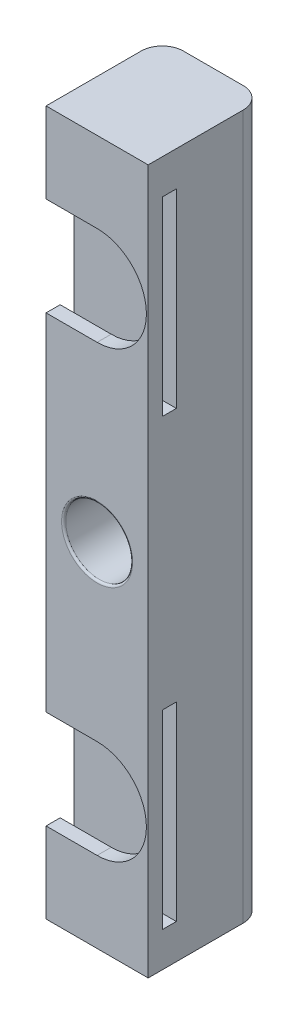
from build123d import *

# Parameters (mm, degrees)
SKETCH7_W           = 100
SKETCH7_H           = 14.5
BOSS_EXTRUDE1_DEPTH = 16.5
SKETCH8_R           = 4.75
CUT_EXTRUDE2_DEPTH  = 16
CUT_EXTRUDE3_START  = -2
SKETCH9_W           = 27
SKETCH9_H           = 27
CUT_EXTRUDE3_DEPTH  = 2
CUT_EXTRUDE4_DEPTH  = 2
FILLET1_R           = 3
FILLET2_R           = 3
FILLET3_R           = 0.3


with BuildPart() as part:
    # Sketch7 → Boss-Extrude1 (new body)
    with BuildSketch(Plane(origin=(0, 0, 0), x_dir=(0, 1, 0), z_dir=(0, 0, 1))):
        Rectangle(SKETCH7_W, SKETCH7_H)
    extrude(amount=BOSS_EXTRUDE1_DEPTH)

    # Sketch8 → Cut-Extrude2 (cut)
    with BuildSketch(Plane(origin=(0, 0, 16.5), x_dir=(0, -1, 0), z_dir=(0, 0, 1))):
        with Locations(Location((0, 0, 0), (0, 0, 90))):
            Circle(SKETCH8_R)
    extrude(amount=-CUT_EXTRUDE2_DEPTH, mode=Mode.SUBTRACT)

    # Sketch9 → Cut-Extrude3 (cut)
    with BuildSketch(Plane.XY.offset(16.5).offset(CUT_EXTRUDE3_START)):
        with Locations((0, -31.55)):
            Rectangle(SKETCH9_W, SKETCH9_H)
    cut_extrude3 = extrude(amount=-CUT_EXTRUDE3_DEPTH, mode=Mode.SUBTRACT)

    # Sketch10 → Cut-Extrude4 (cut)
    with BuildSketch(Plane.XY.offset(16.5)):
        with BuildLine():
            Line((0, -24.55), (-7.25, -24.55))
            Line((-7.25, -24.55), (-7.25, -38.55))
            Line((-7.25, -38.55), (0, -38.55))
            ThreePointArc((0, -38.55), (7, -31.55), (0, -24.55))
        make_face()
    cut_extrude4 = extrude(amount=-CUT_EXTRUDE4_DEPTH, mode=Mode.SUBTRACT)

    # Mirror1: Cut-Extrude3 across plane
    add(cut_extrude3.mirror(Plane.ZX), mode=Mode.SUBTRACT)

    # Mirror2: Cut-Extrude4 across plane
    add(cut_extrude4.mirror(Plane.ZX), mode=Mode.SUBTRACT)

    # Fillet1
    fillet1_edges = [part.edges().sort_by_distance(p)[0] for p in [
        (-7.25, 0, 0),
    ]]
    fillet(fillet1_edges, radius=FILLET1_R)

    # Fillet2
    fillet2_edges = [part.edges().sort_by_distance(p)[0] for p in [
        (7.25, 0, 0),
    ]]
    fillet(fillet2_edges, radius=FILLET2_R)

    # Fillet3
    fillet3_edges = [part.edges().sort_by_distance(p)[0] for p in [
        (-4.75, 0, 16.5),
    ]]
    fillet(fillet3_edges, radius=FILLET3_R)


solid = part.part
